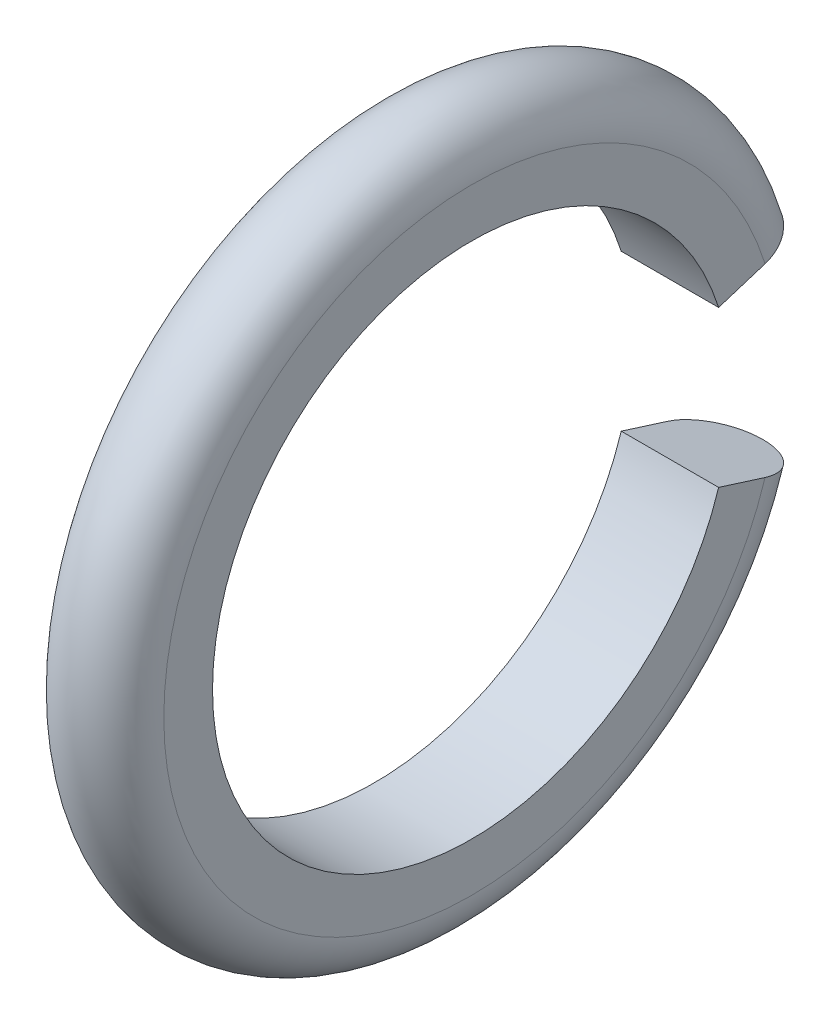
from build123d import *

# Parameters (mm, degrees)
CUT_EXTRUDE1_DEPTH      = 17.510366492
CUT_EXTRUDE1_DEPTH_BACK = 17.510366492


with BuildPart() as part:
    # Sketch1 → Revolve1 (revolve)
    with BuildSketch(Plane.XY, mode=Mode.PRIVATE) as revolve1_sk:
        with BuildLine():
            Line((1.5875, 10.033), (1.5875, 8.4455))
            Line((1.5875, 8.4455), (-1.5875, 8.4455))
            Line((-1.5875, 8.4455), (-1.5875, 10.033))
            ThreePointArc((-1.5875, 10.033), (0, 11.6205), (1.5875, 10.033))
        make_face()
    revolve(revolve1_sk.sketch.rotate(Axis((-5.00914015, 0, 0), (1, 0, 0)), 90), axis=Axis((-5.00914015, 0, 0), (1, 0, 0)))

    # Sketch2 → Cut-Extrude1 (cut, two sides: drawn at the far end of the back side and taken through both)
    with BuildSketch(Plane(origin=(0, 0, 0), x_dir=(0, 0, -1), z_dir=(1, 0, 0)).offset(-CUT_EXTRUDE1_DEPTH_BACK)):
        Polygon((0, 0), (15.195310773, 4.791063083), (15.202038424, -4.793184304), align=None)
    extrude(amount=CUT_EXTRUDE1_DEPTH + CUT_EXTRUDE1_DEPTH_BACK, mode=Mode.SUBTRACT)


solid = part.part
